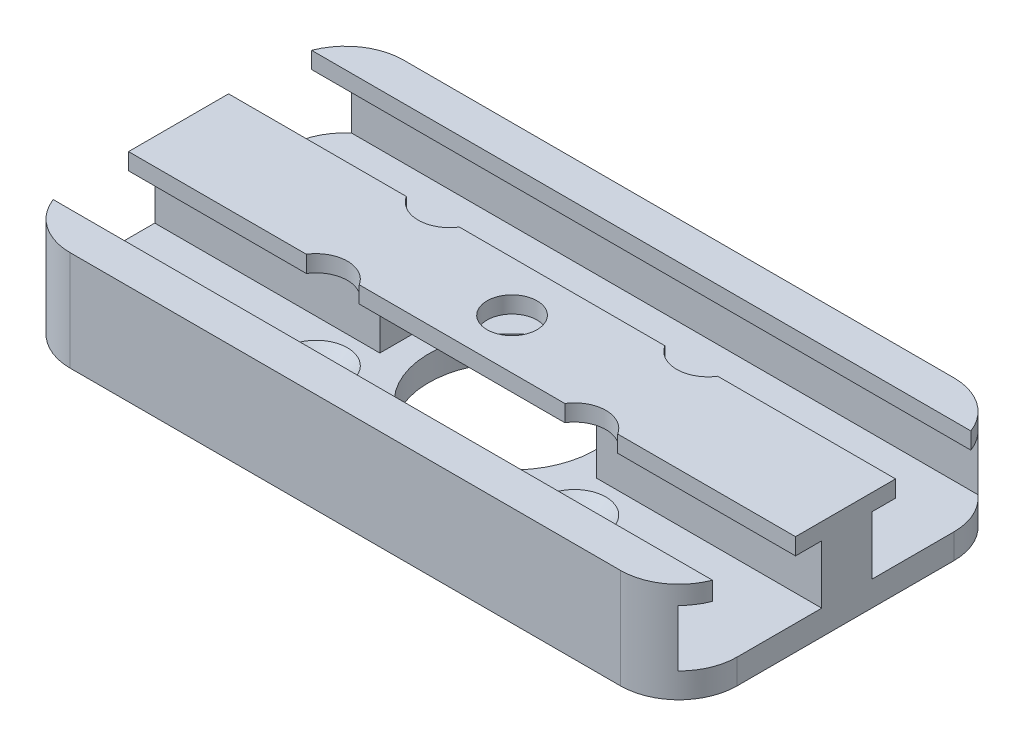
from build123d import *

# Parameters (mm, degrees)
SKETCH1_W                    = 80
SKETCH1_H                    = 40
SKETCH1_R                    = 10
BOSS_EXTRUDE1_DEPTH          = 3
SKETCH2_W                    = 80
SKETCH2_H                    = 4.5
BOSS_EXTRUDE2_DEPTH          = 9
SKETCH3_W                    = 2.8
SKETCH3_H                    = 7
SKETCH3_W_2                  = 2.5
SKETCH3_H_2                  = 6.8
CUT_EXTRUDE1_DEPTH           = 80
SKETCH5_R                    = 1.75
CUT_EXTRUDE3_DEPTH           = 1
SKETCH4_R                    = 3.75
CUT_EXTRUDE4_DEPTH           = 2
CUT_EXTRUDE4_DRAFT           = -45
CUT_EXTRUDE4_PROFILE_2_DEPTH = 2
CUT_EXTRUDE4_PROFILE_2_DRAFT = -45
CUT_EXTRUDE4_PROFILE_3_DEPTH = 2
CUT_EXTRUDE4_PROFILE_3_DRAFT = -45
CUT_EXTRUDE4_PROFILE_4_DEPTH = 2
CUT_EXTRUDE4_PROFILE_4_DRAFT = -45
FILLET1_R                    = 7
SKETCH6_W                    = 27
SKETCH6_H                    = 6
BOSS_EXTRUDE3_DEPTH          = 7
SKETCH7_R                    = 3
BOSS_EXTRUDE4_DEPTH          = 2


with BuildPart() as part:
    # Sketch1 → Boss-Extrude1 (new body)
    with BuildSketch(Plane(origin=(0, 0, 0), x_dir=(1, 0, 0), z_dir=(0, 1, 0))):
        Rectangle(SKETCH1_W, SKETCH1_H)
        with Locations(Location((0, 0, 0), (0, 0, 270))):
            Circle(SKETCH1_R, mode=Mode.SUBTRACT)
    extrude(amount=BOSS_EXTRUDE1_DEPTH)

    # Sketch2 → Boss-Extrude2 (add)
    with BuildSketch(Plane(origin=(0, 3, 0), x_dir=(1, 0, 0), z_dir=(0, 1, 0))):
        with Locations((0, 17.75)):
            Rectangle(SKETCH2_W, SKETCH2_H)
        with Locations((0, -17.75)):
            Rectangle(SKETCH2_W, SKETCH2_H)
    extrude(amount=BOSS_EXTRUDE2_DEPTH)

    # Sketch3 → Cut-Extrude1 (cut)
    with BuildSketch(Plane.ZY.offset(40)):
        with Locations((-16.9, 6.5)):
            Rectangle(SKETCH3_W, SKETCH3_H)
        with Locations((16.75, 6.4)):
            Rectangle(SKETCH3_W_2, SKETCH3_H_2)
    extrude(amount=-CUT_EXTRUDE1_DEPTH, mode=Mode.SUBTRACT)

    # Sketch5 → Cut-Extrude3 (cut)
    with BuildSketch(Plane.XZ):
        with Locations(Location((-15.5, 8, 0), (0, 0, 270))):
            Circle(SKETCH5_R)
        with Locations(Location((-15.5, -8, 0), (0, 0, 270))):
            Circle(SKETCH5_R)
        with Locations(Location((15.5, 8, 0), (0, 0, 270))):
            Circle(SKETCH5_R)
        with Locations(Location((15.5, -8, 0), (0, 0, 270))):
            Circle(SKETCH5_R)
    extrude(amount=-CUT_EXTRUDE3_DEPTH, mode=Mode.SUBTRACT)


with BuildPart() as cut_extrude4_tool:
    # Sketch4 → Cut-Extrude4 (with draft: the straight prism first)
    with BuildSketch(Plane(origin=(0, 3, 0), x_dir=(1, 0, 0), z_dir=(0, 1, 0))):
        with Locations((-15.5, 8)):
            Circle(SKETCH4_R)
    extrude(amount=-CUT_EXTRUDE4_DEPTH)
    # Cut-Extrude4: the draft: its side faces are tilted about the plane it starts from
    cut_extrude4_sides = [cut_extrude4_tool.faces().sort_by_distance(p)[0] for p in [
        (-19.25, 2, -8),
    ]]
    draft(cut_extrude4_sides, Plane(origin=(0, 3, 0), x_dir=(1, 0, 0), z_dir=(0, 1, 0)), CUT_EXTRUDE4_DRAFT)


with BuildPart() as part_1:
    add(part.part)

    # Cut-Extrude4: cut by cut_extrude4_tool
    add(cut_extrude4_tool.part, mode=Mode.SUBTRACT)


with BuildPart() as cut_extrude4_profile_2_tool:
    # Sketch4 → Cut-Extrude4 profile 2 (with draft: the straight prism first)
    with BuildSketch(Plane(origin=(0, 3, 0), x_dir=(1, 0, 0), z_dir=(0, 1, 0))):
        with Locations((-15.5, -8)):
            Circle(SKETCH4_R)
    extrude(amount=-CUT_EXTRUDE4_PROFILE_2_DEPTH)
    # Cut-Extrude4 profile 2: the draft: its side faces are tilted about the plane it starts from
    cut_extrude4_profile_2_sides = [cut_extrude4_profile_2_tool.faces().sort_by_distance(p)[0] for p in [
        (-19.25, 2, 8),
    ]]
    draft(cut_extrude4_profile_2_sides, Plane(origin=(0, 3, 0), x_dir=(1, 0, 0), z_dir=(0, 1, 0)), CUT_EXTRUDE4_PROFILE_2_DRAFT)


with BuildPart() as part_2:
    add(part_1.part)

    # Cut-Extrude4 profile 2: cut by cut_extrude4_profile_2_tool
    add(cut_extrude4_profile_2_tool.part, mode=Mode.SUBTRACT)


with BuildPart() as cut_extrude4_profile_3_tool:
    # Sketch4 → Cut-Extrude4 profile 3 (with draft: the straight prism first)
    with BuildSketch(Plane(origin=(0, 3, 0), x_dir=(1, 0, 0), z_dir=(0, 1, 0))):
        with Locations((15.5, -8)):
            Circle(SKETCH4_R)
    extrude(amount=-CUT_EXTRUDE4_PROFILE_3_DEPTH)
    # Cut-Extrude4 profile 3: the draft: its side faces are tilted about the plane it starts from
    cut_extrude4_profile_3_sides = [cut_extrude4_profile_3_tool.faces().sort_by_distance(p)[0] for p in [
        (11.75, 2, 8),
    ]]
    draft(cut_extrude4_profile_3_sides, Plane(origin=(0, 3, 0), x_dir=(1, 0, 0), z_dir=(0, 1, 0)), CUT_EXTRUDE4_PROFILE_3_DRAFT)


with BuildPart() as part_3:
    add(part_2.part)

    # Cut-Extrude4 profile 3: cut by cut_extrude4_profile_3_tool
    add(cut_extrude4_profile_3_tool.part, mode=Mode.SUBTRACT)


with BuildPart() as cut_extrude4_profile_4_tool:
    # Sketch4 → Cut-Extrude4 profile 4 (with draft: the straight prism first)
    with BuildSketch(Plane(origin=(0, 3, 0), x_dir=(1, 0, 0), z_dir=(0, 1, 0))):
        with Locations((15.5, 8)):
            Circle(SKETCH4_R)
    extrude(amount=-CUT_EXTRUDE4_PROFILE_4_DEPTH)
    # Cut-Extrude4 profile 4: the draft: its side faces are tilted about the plane it starts from
    cut_extrude4_profile_4_sides = [cut_extrude4_profile_4_tool.faces().sort_by_distance(p)[0] for p in [
        (11.75, 2, -8),
    ]]
    draft(cut_extrude4_profile_4_sides, Plane(origin=(0, 3, 0), x_dir=(1, 0, 0), z_dir=(0, 1, 0)), CUT_EXTRUDE4_PROFILE_4_DRAFT)


with BuildPart() as part_4:
    add(part_3.part)

    # Cut-Extrude4 profile 4: cut by cut_extrude4_profile_4_tool
    add(cut_extrude4_profile_4_tool.part, mode=Mode.SUBTRACT)

    # Fillet1
    fillet1_edges = [part_4.edges().sort_by_distance(p)[0] for p in [
        (40, 6, 20),
        (40, 6, -20),
        (-40, 6, 20),
        (-40, 6, -20),
    ]]
    fillet(fillet1_edges, radius=FILLET1_R)

    # Sketch6 → Boss-Extrude3 (add)
    with BuildSketch(Plane(origin=(0, 3, 0), x_dir=(1, 0, 0), z_dir=(0, 1, 0))):
        with Locations((-26.5, 0.145287111)):
            Rectangle(SKETCH6_W, SKETCH6_H)
        with Locations((26.5, 0.145287111)):
            Rectangle(SKETCH6_W, SKETCH6_H)
    extrude(amount=BOSS_EXTRUDE3_DEPTH)

    # Sketch7 → Boss-Extrude4 (add)
    with BuildSketch(Plane(origin=(0, 10, 0), x_dir=(1, 0, 0), z_dir=(0, 1, 0))):
        with BuildLine():
            Line((40, 6), (18.672144385, 6))
            ThreePointArc((18.672144385, 6), (15.5, 4.25), (12.327855615, 6))
            Line((12.327855615, 6), (-12.327855615, 6))
            ThreePointArc((-12.327855615, 6), (-15.5, 4.25), (-18.672144385, 6))
            Line((-18.672144385, 6), (-40, 6))
            Line((-40, 6), (-40, -6))
            Line((-40, -6), (-18.672144385, -6))
            ThreePointArc((-18.672144385, -6), (-15.5, -4.25), (-12.327855615, -6))
            Line((-12.327855615, -6), (12.327855615, -6))
            ThreePointArc((12.327855615, -6), (15.5, -4.25), (18.672144385, -6))
            Line((18.672144385, -6), (40, -6))
            Line((40, -6), (40, 6))
        make_face()
        with Locations(Location((0, 0, 0), (0, 0, 270))):
            Circle(SKETCH7_R, mode=Mode.SUBTRACT)
    extrude(amount=BOSS_EXTRUDE4_DEPTH)


solid = part_4.part
